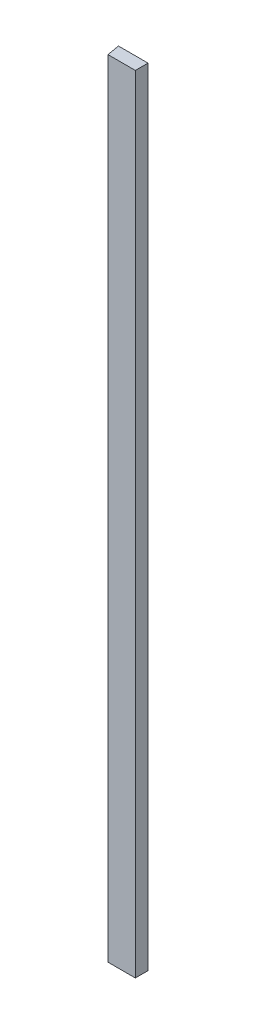
from build123d import *

# Parameters (mm, degrees)
BOSS_EXTRUDE1_DEPTH = 2362.2


with BuildPart() as part:
    # Sketch1 → Boss-Extrude1 (new body)
    with BuildSketch(Plane(origin=(0, 0, 0), x_dir=(1, 0, 0), z_dir=(0, 1, 0))):
        Polygon((-44.45, 19.05), (-37.731942035, -19.05), (44.45, -19.05), (44.45, 19.05), align=None)
    extrude(amount=BOSS_EXTRUDE1_DEPTH)


solid = part.part
